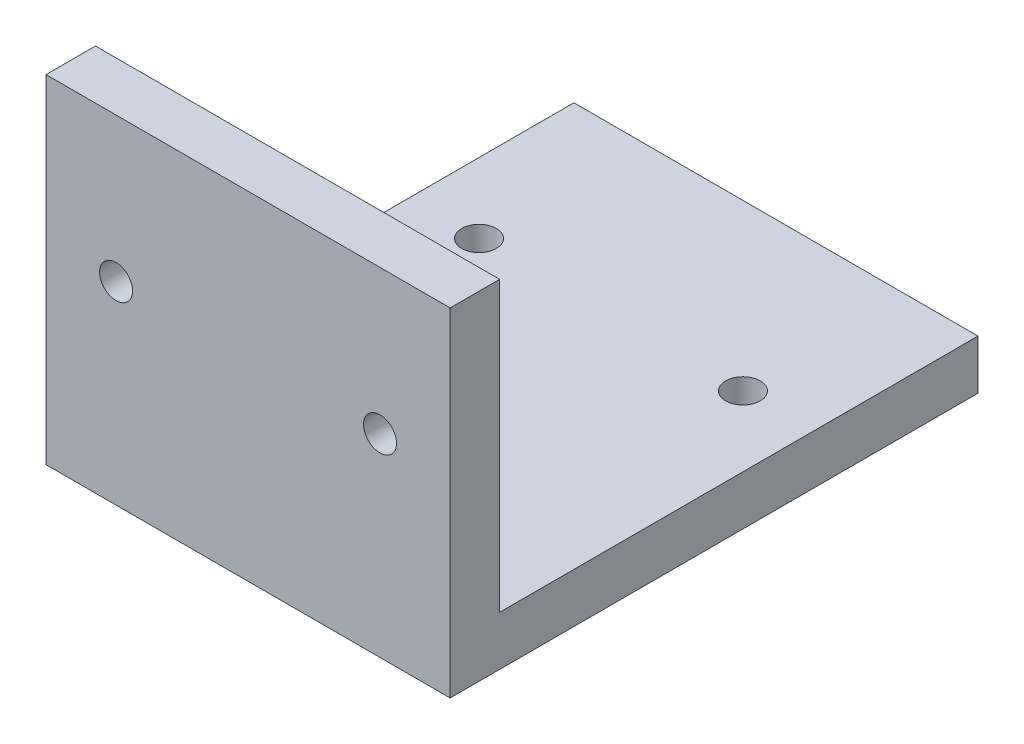
from build123d import *

# Parameters (mm, degrees)
SKETCH1_W           = 24.5
SKETCH1_H           = 32
SKETCH1_R           = 1.05
BOSS_EXTRUDE1_DEPTH = 3
SKETCH3_W           = 24.5
SKETCH3_H           = 3
BOSS_EXTRUDE3_DEPTH = 17.48
SKETCH4_R           = 1
CUT_EXTRUDE1_DEPTH  = 10


with BuildPart() as part:
    # Sketch1 → Boss-Extrude1 (new body)
    with BuildSketch(Plane(origin=(0, 0, 0), x_dir=(1, 0, 0), z_dir=(0, 1, 0))):
        Rectangle(SKETCH1_W, SKETCH1_H)
        with Locations(Location((8, 6, 0), (0, 0, 270))):
            Circle(SKETCH1_R, mode=Mode.SUBTRACT)
        with Locations(Location((-8, 6, 0), (0, 0, 270))):
            Circle(SKETCH1_R, mode=Mode.SUBTRACT)
    extrude(amount=BOSS_EXTRUDE1_DEPTH)

    # Sketch3 → Boss-Extrude3 (add)
    with BuildSketch(Plane(origin=(0, 3, 0), x_dir=(1, 0, 0), z_dir=(0, 1, 0))):
        with Locations((0, -14.5)):
            Rectangle(SKETCH3_W, SKETCH3_H)
    extrude(amount=BOSS_EXTRUDE3_DEPTH)

    # Sketch4 → Cut-Extrude1 (cut)
    with BuildSketch(Plane(origin=(0, 0, 13), x_dir=(-1, 0, 0), z_dir=(0, 0, -1))):
        with Locations((8, 11.74)):
            Circle(SKETCH4_R)
        with Locations((-8, 11.74)):
            Circle(SKETCH4_R)
    extrude(amount=-CUT_EXTRUDE1_DEPTH, mode=Mode.SUBTRACT)


solid = part.part
